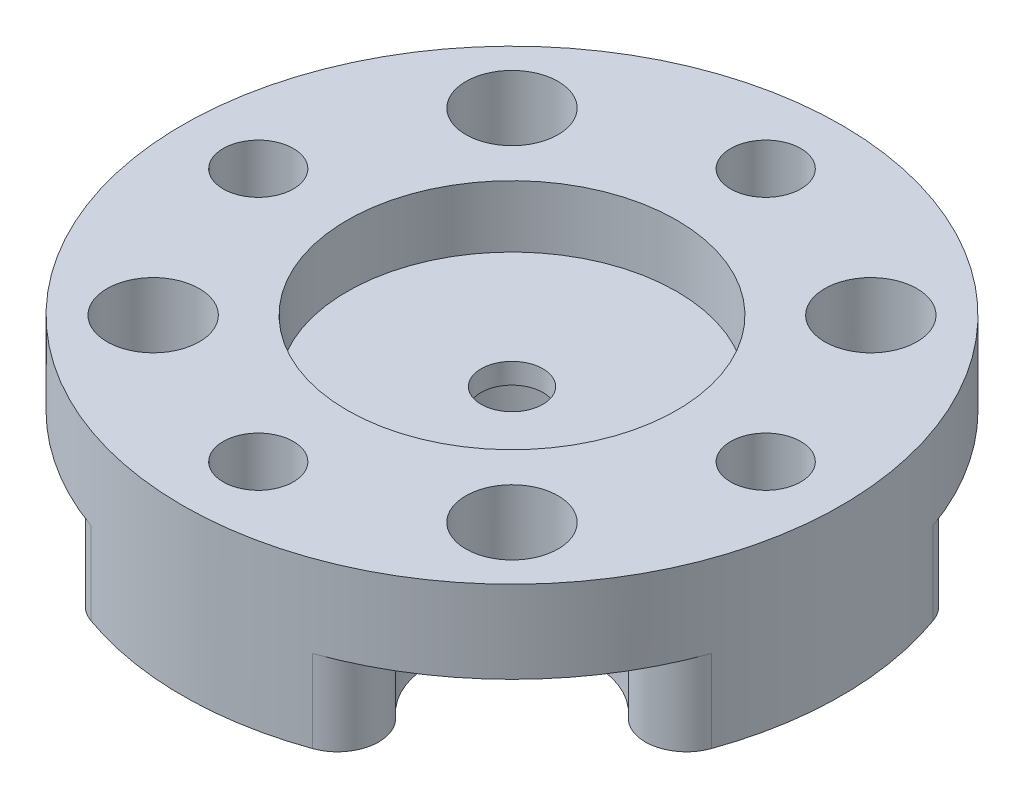
from build123d import *

# Parameters (mm, degrees)
SKETCH1_R             = 12.7
BOSS_EXTRUDE1_DEPTH   = 6.35
SKETCH2_R             = 6.35
CUT_EXTRUDE1_DEPTH    = 2.38125
SKETCH3_R             = 3.1115
CUT_EXTRUDE2_DEPTH    = 3.175
SKETCH4_R             = 1.190625
CUT_EXTRUDE3_DEPTH    = 19.393775484
F_6_32_TAPPED_HOLE1_D = 2.7051
SKETCH7_R             = 1.778
CUT_EXTRUDE4_DEPTH    = 20.05
SKETCH8_R             = 3.175
CUT_EXTRUDE5_DEPTH    = 3.175
CIRPATTERN2_COUNT     = 4
FILLET1_R             = 1.5875


with BuildPart() as part:
    # Sketch1 → Boss-Extrude1 (new body)
    with BuildSketch(Plane(origin=(0, 0, 0), x_dir=(1, 0, 0), z_dir=(0, 1, 0))):
        with Locations(Location((0, 0, 0), (0, 0, 270))):
            Circle(SKETCH1_R)
    extrude(amount=BOSS_EXTRUDE1_DEPTH)

    # Sketch2 → Cut-Extrude1 (cut)
    with BuildSketch(Plane(origin=(0, 6.35, 0), x_dir=(1, 0, 0), z_dir=(0, 1, 0))):
        with Locations(Location((0, 0, 0), (0, 0, 270))):
            Circle(SKETCH2_R)
    extrude(amount=-CUT_EXTRUDE1_DEPTH, mode=Mode.SUBTRACT)

    # Sketch3 → Cut-Extrude2 (cut)
    with BuildSketch(Plane.XZ):
        with Locations(Location((0, 0, 0), (0, 0, 270))):
            Circle(SKETCH3_R)
    extrude(amount=-CUT_EXTRUDE2_DEPTH, mode=Mode.SUBTRACT)

    # Sketch4 → Cut-Extrude3 (cut, through all)
    with BuildSketch(Plane(origin=(0, 3.96875, 0), x_dir=(1, 0, 0), z_dir=(0, 1, 0))):
        with Locations(Location((0, 0, 0), (0, 0, 270))):
            Circle(SKETCH4_R)
    extrude(amount=-CUT_EXTRUDE3_DEPTH, mode=Mode.SUBTRACT)

    # #6-32 Tapped Hole1 (through all)
    with Locations(Plane(origin=(0, 6.35, 0), x_dir=(1, 0, 0), z_dir=(0, 1, 0))):
        with Locations((-9.779, 0)):
            f_6_32_tapped_hole1 = Hole(F_6_32_TAPPED_HOLE1_D / 2)

    # Sketch7 → Cut-Extrude4 (cut, through all)
    with BuildSketch(Plane(origin=(0, 6.35, 0), x_dir=(1, 0, 0), z_dir=(0, 1, 0))):
        with Locations(Location((6.914797213, -6.914797213, 0), (0, 0, 270))):
            Circle(SKETCH7_R)
    cut_extrude4 = extrude(amount=-CUT_EXTRUDE4_DEPTH, mode=Mode.SUBTRACT)

    # Sketch8 → Cut-Extrude5 (cut)
    with BuildSketch(Plane.XZ):
        with Locations((6.914797213, 6.914797213)):
            Circle(SKETCH8_R)
    cut_extrude5 = extrude(amount=-CUT_EXTRUDE5_DEPTH, mode=Mode.SUBTRACT)

    # CirPattern2: #6-32 Tapped Hole1, Cut-Extrude4, Cut-Extrude5 ×4 about axis
    cirpattern2_axis = Axis((0, 0, 0), (0, 1, 0))
    add([f_6_32_tapped_hole1.rotate(cirpattern2_axis, i * 360 / CIRPATTERN2_COUNT) for i in range(1, CIRPATTERN2_COUNT)], mode=Mode.SUBTRACT)
    add([cut_extrude4.rotate(cirpattern2_axis, i * 360 / CIRPATTERN2_COUNT) for i in range(1, CIRPATTERN2_COUNT)], mode=Mode.SUBTRACT)
    add([cut_extrude5.rotate(cirpattern2_axis, i * 360 / CIRPATTERN2_COUNT) for i in range(1, CIRPATTERN2_COUNT)], mode=Mode.SUBTRACT)

    # Fillet1
    fillet1_edges = [part.edges().sort_by_distance(p)[0] for p in [
        (7.923120818, 1.5875, 9.925429789),
        (9.925429789, 1.5875, 7.923120818),
        (9.925429789, 1.5875, -7.923120818),
        (7.923120818, 1.5875, -9.925429789),
        (-7.923120818, 1.5875, -9.925429789),
        (-9.925429789, 1.5875, -7.923120818),
        (-9.925429789, 1.5875, 7.923120818),
        (-7.923120818, 1.5875, 9.925429789),
    ]]
    fillet(fillet1_edges, radius=FILLET1_R)


solid = part.part
